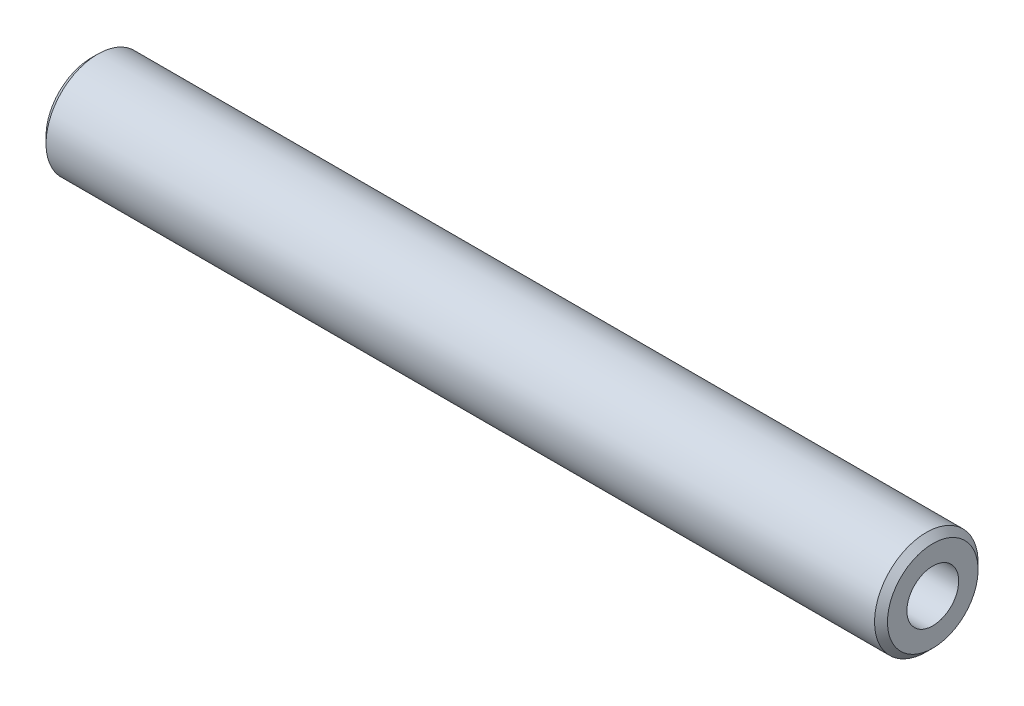
from build123d import *

# Parameters (mm, degrees)
SKETCH_1_W                     = 65
SKETCH_1_H                     = 4
M4X0_7_1_D                     = 3.3
M4X0_7_1_DEPTH                 = 11.5
M4X0_7_1_CBORE_D               = 4
M4X0_7_1_CBORE_DEPTH           = 8
M4X0_7_1_TIP                   = 0.991420021
M4X0_7_1_ON_FACE_2_D           = 3.3
M4X0_7_1_ON_FACE_2_DEPTH       = 11.5
M4X0_7_1_ON_FACE_2_CBORE_D     = 4
M4X0_7_1_ON_FACE_2_CBORE_DEPTH = 8
M4X0_7_1_ON_FACE_2_TIP         = 0.991420021
CHAMFER_1_SIZE                 = 0.5


with BuildPart() as part:
    # ｽｹｯﾁ1 → 回転1 (revolve)
    with BuildSketch(Plane.XY, mode=Mode.PRIVATE) as revolve_1_sk:
        with Locations((0, 2)):
            Rectangle(SKETCH_1_W, SKETCH_1_H)
    revolve(revolve_1_sk.sketch.rotate(Axis((0, 0, 0), (1, 0, 0)), 90), axis=Axis((0, 0, 0), (1, 0, 0)))

    # M4x0.7 ねじ穴1
    with Locations(Plane(origin=(32.5, 0, 0), x_dir=(0, 0, 1), z_dir=(1, 0, 0))):
        with Locations((0, 0)):
            CounterBoreHole(M4X0_7_1_D / 2, M4X0_7_1_CBORE_D / 2, M4X0_7_1_CBORE_DEPTH, depth=M4X0_7_1_DEPTH)
            with Locations((0, 0, -(M4X0_7_1_DEPTH + M4X0_7_1_TIP / 2))):  # 118° drill point
                Cone(0, M4X0_7_1_D / 2, M4X0_7_1_TIP, mode=Mode.SUBTRACT)

    # M4x0.7 ねじ穴1 on face 2
    with Locations(Plane(origin=(-32.5, 0, 0), x_dir=(0, 0, -1), z_dir=(-1, 0, 0))):
        with Locations((0, 0)):
            CounterBoreHole(M4X0_7_1_ON_FACE_2_D / 2, M4X0_7_1_ON_FACE_2_CBORE_D / 2, M4X0_7_1_ON_FACE_2_CBORE_DEPTH, depth=M4X0_7_1_ON_FACE_2_DEPTH)
            with Locations((0, 0, -(M4X0_7_1_ON_FACE_2_DEPTH + M4X0_7_1_ON_FACE_2_TIP / 2))):  # 118° drill point
                Cone(0, M4X0_7_1_ON_FACE_2_D / 2, M4X0_7_1_ON_FACE_2_TIP, mode=Mode.SUBTRACT)

    # 面取り1
    chamfer_1_edges = [part.edges().sort_by_distance(p)[0] for p in [
        (32.5, 0, -4),
        (-32.5, 0, -4),
    ]]
    chamfer(chamfer_1_edges, length=CHAMFER_1_SIZE)


solid = part.part
